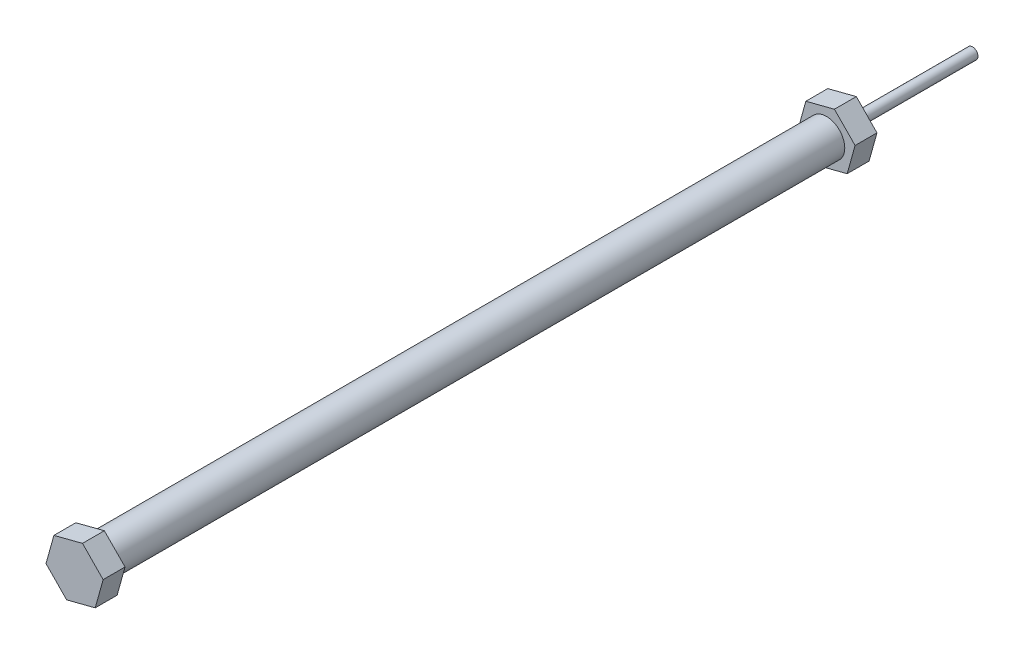
from build123d import *

# Parameters (mm, degrees)
SKETCH_1_R      = 2.5
EXTRUDE_1_DEPTH = 100
EXTRUDE_2_DEPTH = 3
EXTRUDE_START   = 100
EXTRUDE_3_DEPTH = 3
SKETCH_5_R      = 0.75
EXTRUDE_4_DEPTH = 20


with BuildPart() as part:
    # 草圖1 → 填料-伸長1 (new body)
    with BuildSketch(Plane.XY):
        Circle(SKETCH_1_R)
    extrude(amount=EXTRUDE_1_DEPTH)

    # 草圖3 → 填料-伸長2 (add)
    with BuildSketch(Plane.XY):
        Polygon((1.082752823, 3.893710269), (-2.830675596, 2.884546585), (-3.913428419, -1.009163684), (-1.082752823, -3.893710269), (2.830675596, -2.884546585), (3.913428419, 1.009163684), align=None)
    extrude(amount=-EXTRUDE_2_DEPTH)

    # 草圖4 → 填料-伸長3 (add)
    with BuildSketch(Plane.XY.offset(EXTRUDE_START)):
        Polygon((-2.830675596, 2.884546585), (-3.913428419, -1.009163684), (-1.082752823, -3.893710269), (2.830675596, -2.884546585), (3.913428419, 1.009163684), (1.082752823, 3.893710269), align=None)
    extrude(amount=EXTRUDE_3_DEPTH)

    # 草圖5 → 填料-伸長4 (add)
    with BuildSketch(Plane.XY):
        Circle(SKETCH_5_R)
    extrude(amount=-EXTRUDE_4_DEPTH)


solid = part.part
